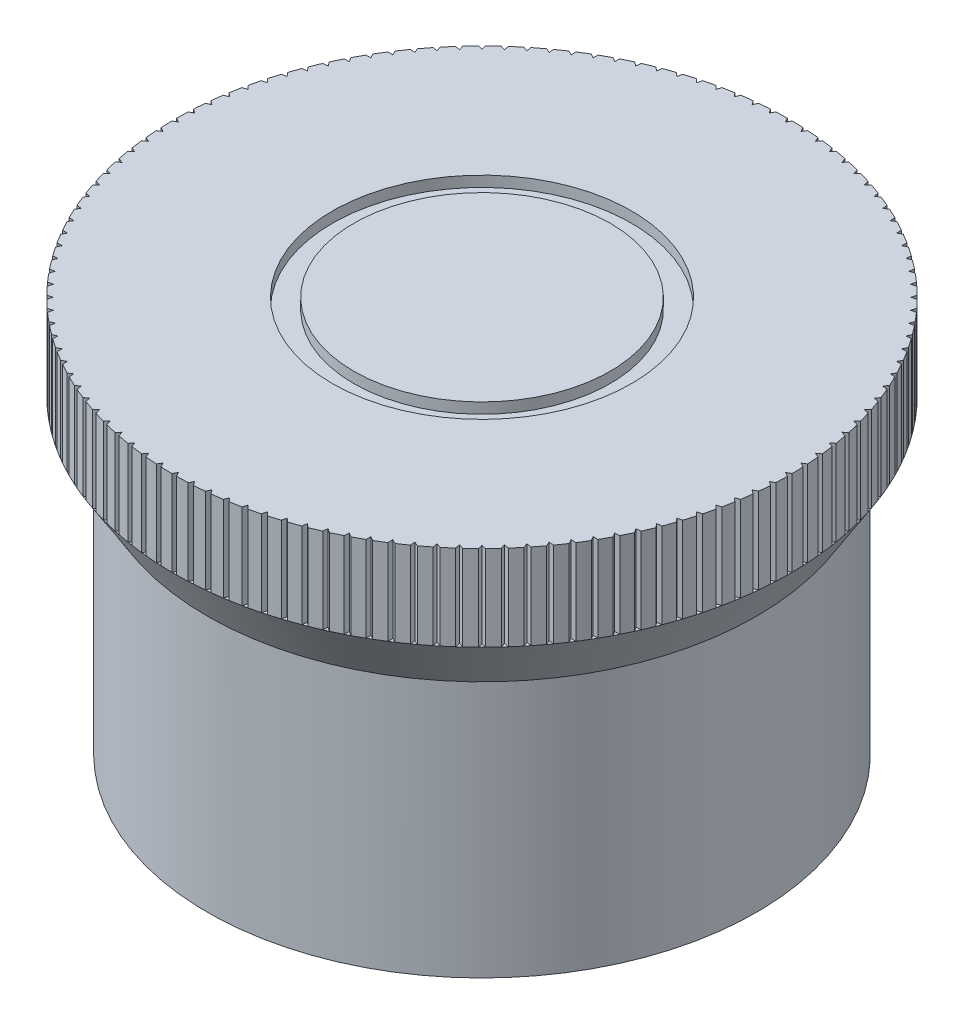
from build123d import *

# Parameters (mm, degrees)
SKETCH_1_R               = 14.4
EXTRUDE_1_DEPTH          = 4
CUT_EXTRUDE_1_DEPTH      = 21.753794834
PATTERN_CIRCULAR_1_COUNT = 120
SKETCH_8_R               = 7
SKETCH_8_R_2             = 6
CUT_EXTRUDE_2_DEPTH      = 0.5
SKETCH_10_R              = 14.4
SKETCH_9_R               = 12.85
SKETCH_11_R              = 12.85
EXTRUDE_2_DEPTH          = 12


with BuildPart() as part:
    # ｽｹｯﾁ1 → ﾎﾞｽ - 押し出し1 (new body)
    with BuildSketch(Plane(origin=(0, 0, 0), x_dir=(1, 0, 0), z_dir=(0, 1, 0))):
        with Locations(Location((0, 0, 0), (0, 0, 270))):
            Circle(SKETCH_1_R)
    extrude(amount=EXTRUDE_1_DEPTH)

    # ｽｹｯﾁ3 → ｶｯﾄ - 押し出し1 (cut, through all)
    with BuildSketch(Plane(origin=(0, 4, 0), x_dir=(1, 0, 0), z_dir=(0, 1, 0))):
        with BuildLine():
            Line((-14.399539161, 0.115203988), (-14.2, 0))
            Line((-14.2, 0), (-14.399539161, -0.115203988))
            ThreePointArc((-14.399539161, -0.115203988), (-14.4, 0), (-14.399539161, 0.115203988))
        make_face()
    cut_extrude_1 = extrude(amount=-CUT_EXTRUDE_1_DEPTH, mode=Mode.SUBTRACT)

    # 円形ﾊﾟﾀｰﾝ1: ｶｯﾄ - 押し出し1 ×120 about axis
    pattern_circular_1_axis = Axis((0, 0, 0), (0, 1, 0))
    for i in range(1, PATTERN_CIRCULAR_1_COUNT):
        add(cut_extrude_1.rotate(pattern_circular_1_axis, i * 360 / PATTERN_CIRCULAR_1_COUNT), mode=Mode.SUBTRACT)

    # ｽｹｯﾁ8 → ｶｯﾄ - 押し出し2 (cut)
    with BuildSketch(Plane(origin=(0, 4, 0), x_dir=(1, 0, 0), z_dir=(0, 1, 0))):
        with Locations(Location((0, 0, 0), (0, 0, 270))):
            Circle(SKETCH_8_R)
        with Locations(Location((0, 0, 0), (0, 0, 270))):
            Circle(SKETCH_8_R_2, mode=Mode.SUBTRACT)
    extrude(amount=-CUT_EXTRUDE_2_DEPTH, mode=Mode.SUBTRACT)

    # ｽｹｯﾁ10 → ﾛﾌﾄ2 section 0
    with BuildSketch(Plane.XZ):
        Circle(SKETCH_10_R)
    # ｽｹｯﾁ9 → ﾛﾌﾄ2 section 1
    with BuildSketch(Plane(origin=(0, -2.5, 0), x_dir=(-1, 0, 0), z_dir=(0, 1, 0))):
        Circle(SKETCH_9_R)
    loft()

    # ｽｹｯﾁ11 → ﾎﾞｽ - 押し出し2 (add)
    with BuildSketch(Plane.XZ.offset(2.5)):
        with Locations(Location((0, 0, 0), (0, 0, 270))):
            Circle(SKETCH_11_R)
    extrude(amount=EXTRUDE_2_DEPTH)


solid = part.part
